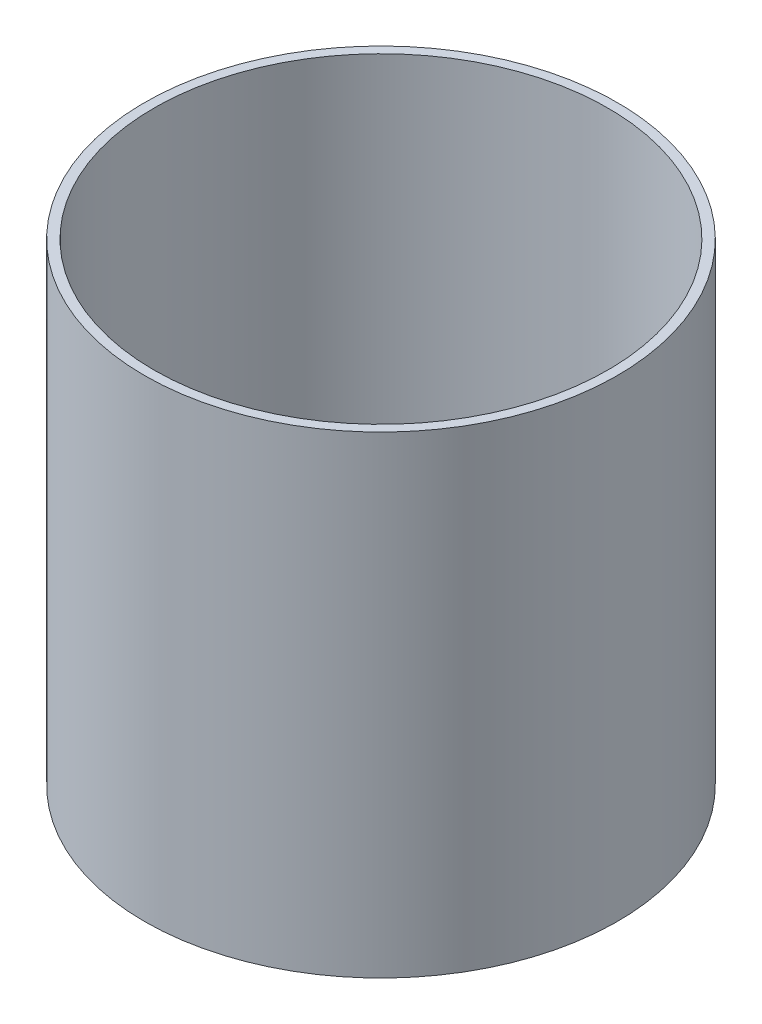
from build123d import *

# Parameters (mm, degrees)
SKETCH1_R           = 250
SKETCH1_R_2         = 240
BOSS_EXTRUDE1_DEPTH = 500


with BuildPart() as part:
    # Sketch1 → Boss-Extrude1 (new body)
    with BuildSketch(Plane(origin=(0, 0, 0), x_dir=(1, 0, 0), z_dir=(0, 1, 0))):
        with Locations(Location((0, 0, 0), (0, 0, 270))):
            Circle(SKETCH1_R)
        with Locations(Location((0, 0, 0), (0, 0, 270))):
            Circle(SKETCH1_R_2, mode=Mode.SUBTRACT)
    extrude(amount=BOSS_EXTRUDE1_DEPTH)


solid = part.part
